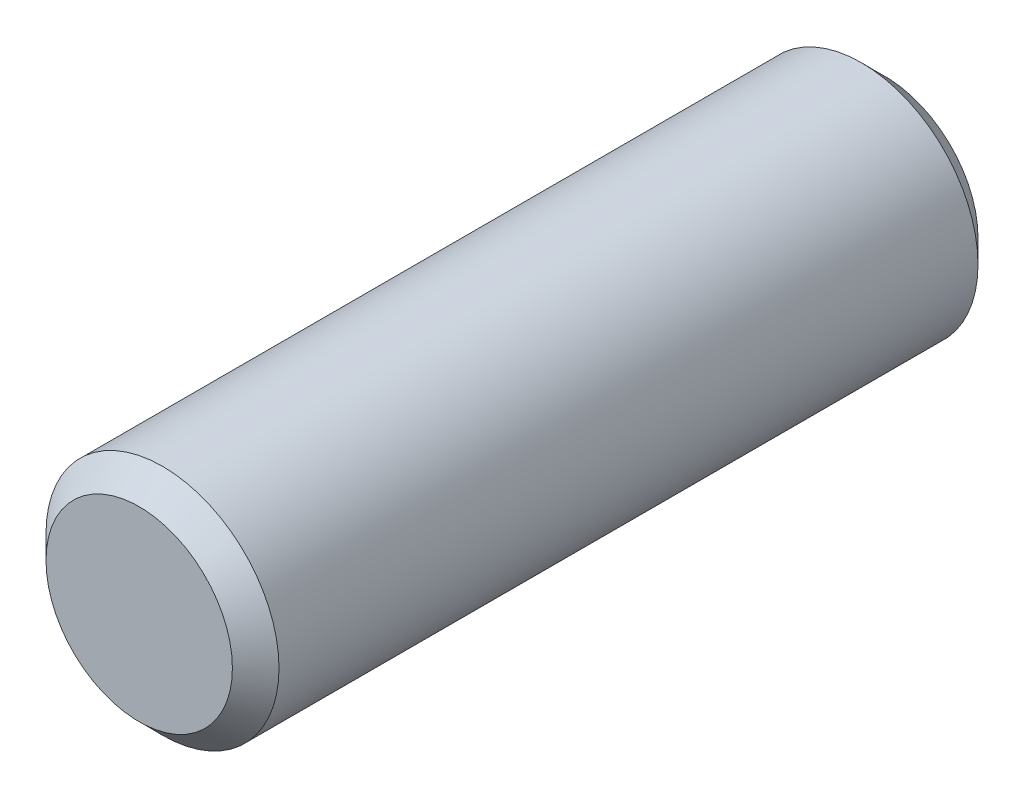
from build123d import *

# Parameters (mm, degrees)
SKETCH1_R           = 2.5
BOSS_EXTRUDE1_DEPTH = 8
CHAMFER1_SIZE       = 0.5


with BuildPart() as part:
    # Sketch1 → Boss-Extrude1 (new, symmetric)
    with BuildSketch(Plane.XY):
        Circle(SKETCH1_R)
    extrude(amount=BOSS_EXTRUDE1_DEPTH, both=True)

    # Chamfer1
    chamfer1_edges = [part.edges().sort_by_distance(p)[0] for p in [
        (-2.5, 0, -8),
        (-2.5, 0, 8),
    ]]
    chamfer(chamfer1_edges, length=CHAMFER1_SIZE)


solid = part.part
